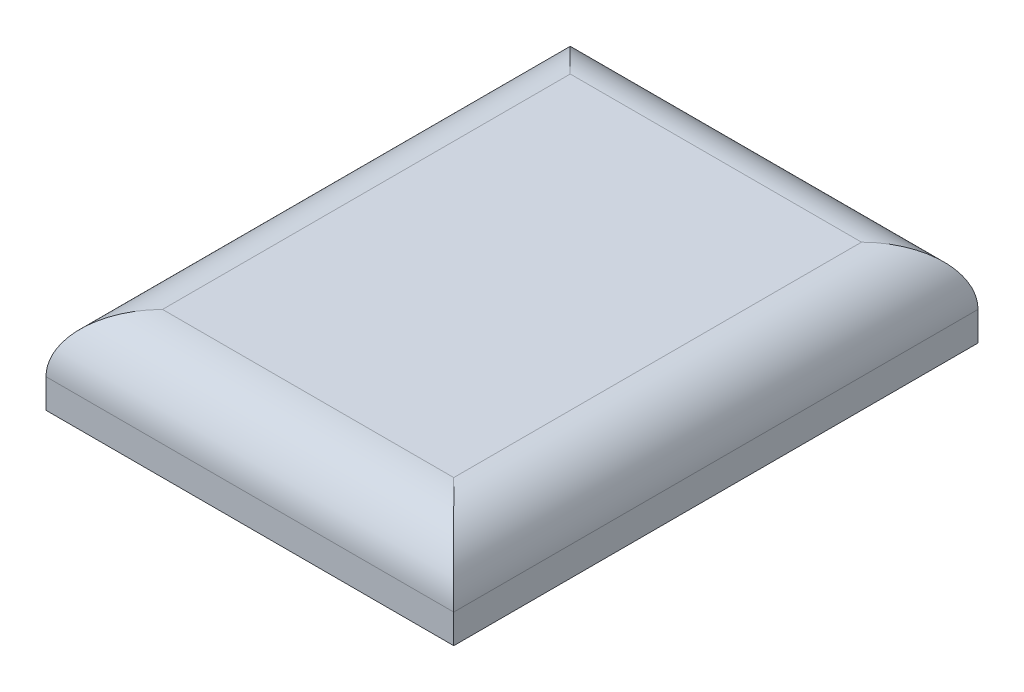
from build123d import *

# Parameters (mm, degrees)
SKETCH1_W           = 70
SKETCH1_H           = 90
BOSS_EXTRUDE1_DEPTH = 15
FILLET1_R           = 10


with BuildPart() as part:
    # Sketch1 → Boss-Extrude1 (new body)
    with BuildSketch(Plane(origin=(0, 0, 0), x_dir=(1, 0, 0), z_dir=(0, 1, 0))):
        Rectangle(SKETCH1_W, SKETCH1_H)
    extrude(amount=BOSS_EXTRUDE1_DEPTH)

    # Fillet1
    fillet1_edges = [part.edges().sort_by_distance(p)[0] for p in [
        (-35, 15, 0),
        (0, 15, 45),
        (35, 15, 0),
        (0, 15, -45),
    ]]
    fillet(fillet1_edges, radius=FILLET1_R)


solid = part.part
